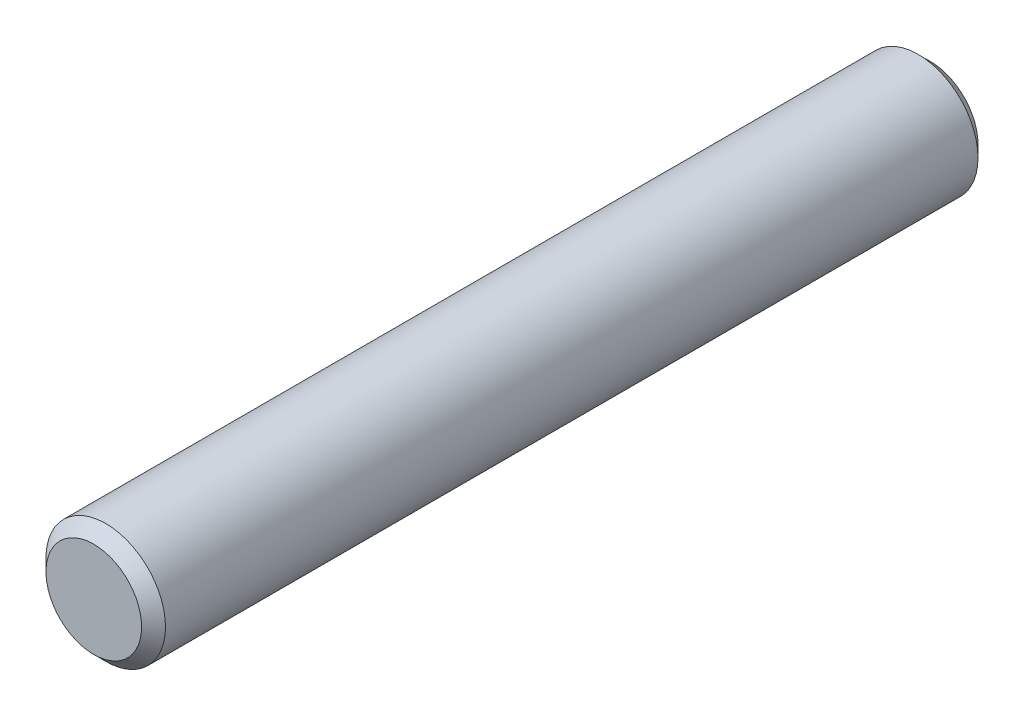
from build123d import *

# Parameters (mm, degrees)
SCHIZZO1_R                   = 5
ESTRUSIONE_ESTRUSIONE1_DEPTH = 70
SMUSSO1_SIZE                 = 1


with BuildPart() as part:
    # Schizzo1 → Estrusione-Estrusione1 (new body)
    with BuildSketch(Plane.XY):
        Circle(SCHIZZO1_R)
    extrude(amount=ESTRUSIONE_ESTRUSIONE1_DEPTH)

    # Smusso1
    smusso1_edges = [part.edges().sort_by_distance(p)[0] for p in [
        (-5, 0, 0),
        (-5, 0, 70),
    ]]
    chamfer(smusso1_edges, length=SMUSSO1_SIZE)


solid = part.part
